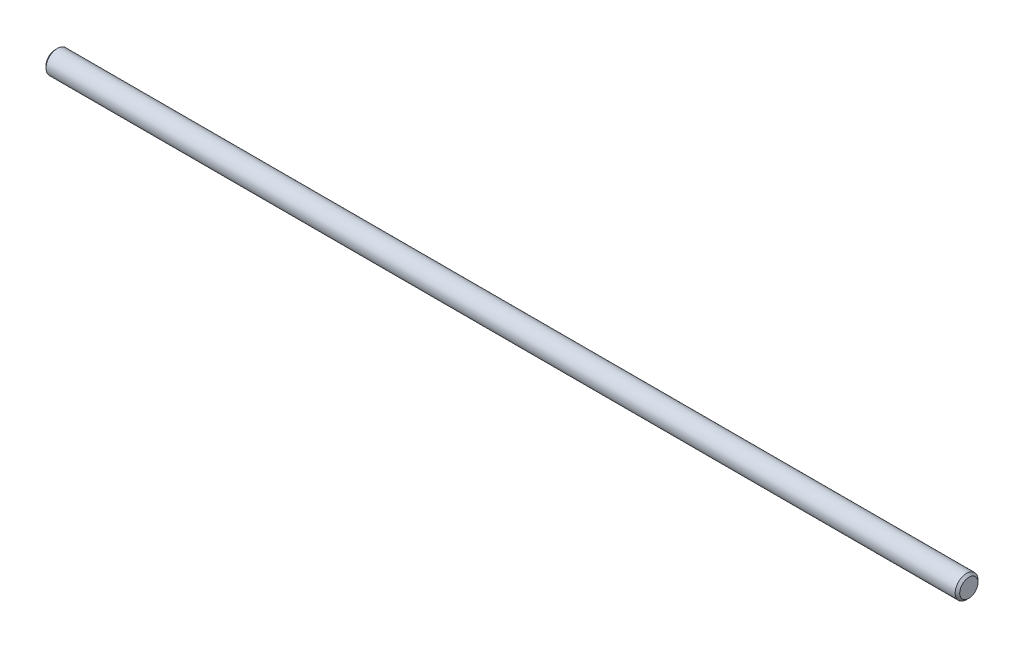
from build123d import *

# Parameters (mm, degrees)
EXTRUDE1_DEPTH      = 127
EXTRUDE1_DEPTH_BACK = 127
SKETCH2_R           = 3.175
CHAMFER1_SIZE       = 0.635


with BuildPart() as part:
    # Sketch2 → Extrude1 (new, two sides: drawn at the far end of the back side and taken through both)
    with BuildSketch(Plane(origin=(0, 0, 0), x_dir=(0, 0, -1), z_dir=(1, 0, 0)).offset(-EXTRUDE1_DEPTH_BACK)):
        Circle(SKETCH2_R)
    extrude(amount=EXTRUDE1_DEPTH + EXTRUDE1_DEPTH_BACK)

    # Chamfer1
    chamfer1_edges = [part.edges().sort_by_distance(p)[0] for p in [
        (-127, 0, 3.175),
        (127, 0, 3.175),
    ]]
    chamfer(chamfer1_edges, length=CHAMFER1_SIZE)


solid = part.part
